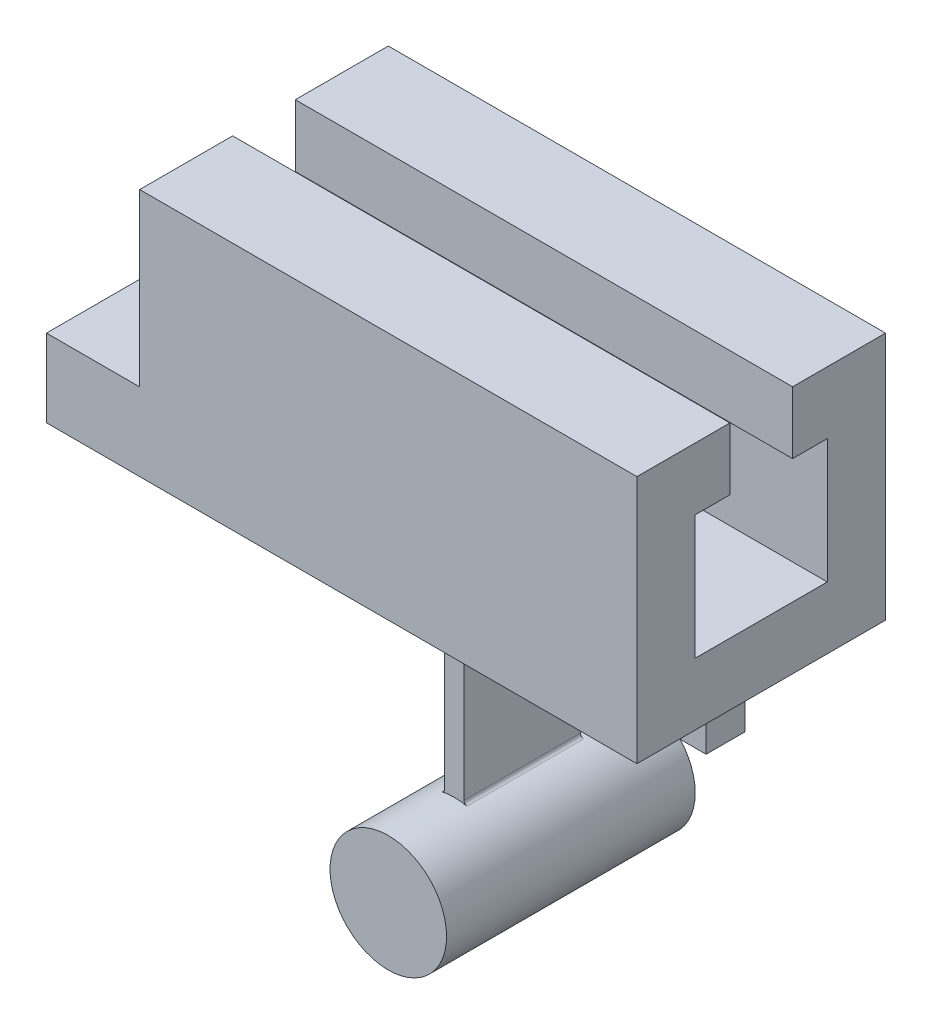
from build123d import *

# Parameters (mm, degrees)
SKETCH1_W           = 50.8
SKETCH1_H           = 50.8
BOSS_EXTRUDE1_DEPTH = 50.8
SKETCH2_W           = 12.8016
SKETCH2_H           = 12.71524
SKETCH2_W_2         = 26.9875
SKETCH2_H_2         = 25.36952
CUT_EXTRUDE1_DEPTH  = 108.763073453
SKETCH3_W           = 3.96875
SKETCH3_H           = 23.8125
BOSS_EXTRUDE2_DEPTH = 50.00625
SKETCH4_R           = 11.90625
BOSS_EXTRUDE3_DEPTH = 25.4
SKETCH5_W           = 50.8
SKETCH5_H           = 15.875
BOSS_EXTRUDE4_DEPTH = 19.05
SKETCH6_W           = 7.9375
SKETCH6_H           = 7.9375
BOSS_EXTRUDE5_DEPTH = 12.7
FILLET1_R           = 0.762


with BuildPart() as part:
    # Sketch1 → Boss-Extrude1 (new, symmetric)
    with BuildSketch(Plane(origin=(0, 0, 0), x_dir=(0, 0, -1), z_dir=(1, 0, 0))):
        Rectangle(SKETCH1_W, SKETCH1_H)
    extrude(amount=BOSS_EXTRUDE1_DEPTH, both=True)

    # Sketch2 → Cut-Extrude1 (cut, through all)
    with BuildSketch(Plane(origin=(50.8, 0, 0), x_dir=(0, 0, -1), z_dir=(1, 0, 0))):
        with Locations((0, 19.04238)):
            Rectangle(SKETCH2_W, SKETCH2_H)
        Rectangle(SKETCH2_W_2, SKETCH2_H_2)
    extrude(amount=-CUT_EXTRUDE1_DEPTH, mode=Mode.SUBTRACT)

    # Sketch3 → Boss-Extrude2 (add)
    with BuildSketch(Plane.XZ.offset(25.4)):
        Rectangle(SKETCH3_W, SKETCH3_H)
    extrude(amount=BOSS_EXTRUDE2_DEPTH)

    # Sketch4 → Boss-Extrude3 (add, symmetric)
    with BuildSketch(Plane.XY):
        with Locations((0, -75.40625)):
            Circle(SKETCH4_R)
    extrude(amount=BOSS_EXTRUDE3_DEPTH, both=True)

    # Sketch5 → Boss-Extrude4 (add)
    with BuildSketch(Plane.ZY.offset(50.8)):
        with Locations((0, -17.4625)):
            Rectangle(SKETCH5_W, SKETCH5_H)
    extrude(amount=BOSS_EXTRUDE4_DEPTH)

    # Sketch6 → Boss-Extrude5 (add)
    with BuildSketch(Plane.XZ.offset(25.4)):
        with Locations((39.53002, 0)):
            Rectangle(SKETCH6_W, SKETCH6_H)
    extrude(amount=BOSS_EXTRUDE5_DEPTH)

    # Fillet1
    fillet1_edges = [part.edges().sort_by_distance(p)[0] for p in [
        (-50.8, -12.68476, 0),
        (1.984375, -63.66652918, 0),
        (-1.984375, -63.66652918, 0),
    ]]
    fillet(fillet1_edges, radius=FILLET1_R)


solid = part.part
